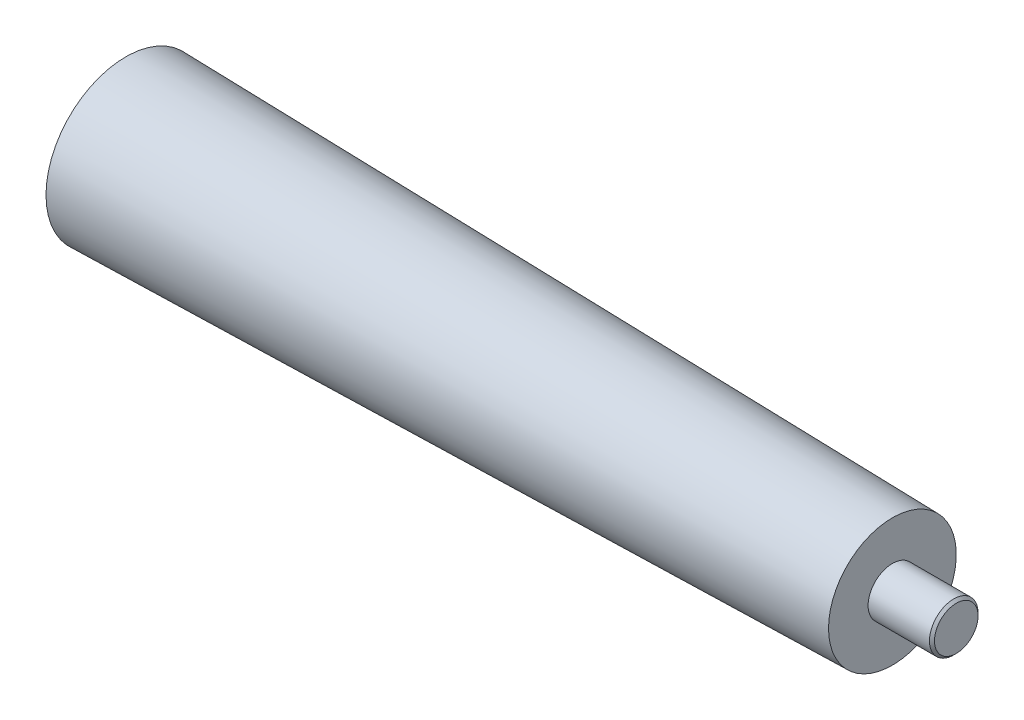
from build123d import *

# Parameters (mm, degrees)
CHAMFER1_SIZE = 0.5


with BuildPart() as part:
    # Sketch1 → Revolve1 (revolve)
    with BuildSketch(Plane(origin=(0, 0, 0), x_dir=(1, 0, 0), z_dir=(0, 1, 0)), mode=Mode.PRIVATE) as revolve1_sk:
        Polygon((0, 0), (165.1, 0), (165.1, 4.83), (152.4, 4.83), (152.4, 12.7), (0, 15.88), align=None)
    revolve(revolve1_sk.sketch.rotate(Axis((0, 0, 0), (1, 0, 0)), 180), axis=Axis((0, 0, 0), (1, 0, 0)))

    # Chamfer1
    chamfer1_edges = [part.edges().sort_by_distance(p)[0] for p in [
        (165.1, 0, -4.83),
    ]]
    chamfer(chamfer1_edges, length=CHAMFER1_SIZE)


solid = part.part
